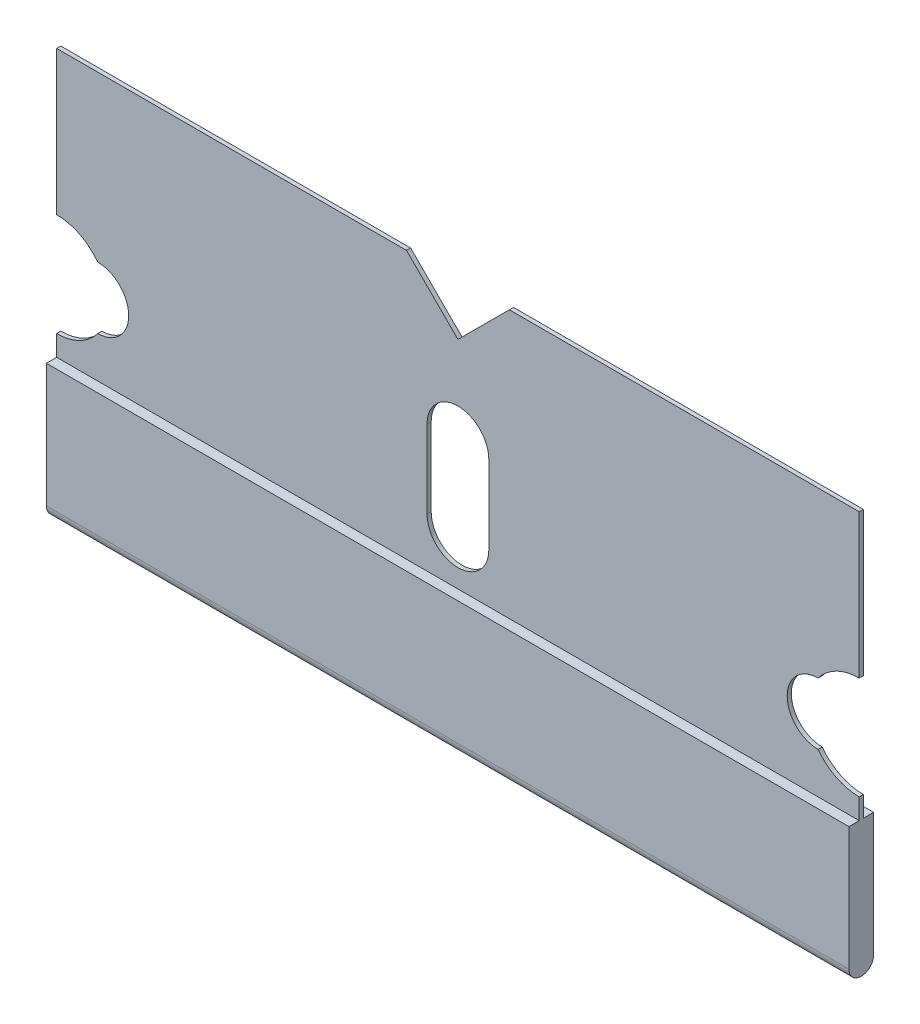
from build123d import *

# Parameters (mm, degrees)
BOSS_EXTRUDE1_DEPTH = 0.2
BOSS_EXTRUDE2_DEPTH = 39
CUT_EXTRUDE1_DEPTH  = 10


with BuildPart() as part:
    # Sketch1 → Boss-Extrude1 (new body)
    with BuildSketch(Plane.XY):
        with BuildLine():
            Line((0, 0), (39, 0))
            Line((39, 0), (39, 7.5))
            ThreePointArc((39, 7.5), (37.881966011, 7.763932023), (37, 8.5))
            ThreePointArc((37, 8.5), (35.5, 10), (37, 11.5))
            ThreePointArc((37, 11.5), (37.881966011, 12.236067977), (39, 12.5))
            Line((39, 12.5), (39, 19.5))
            Line((39, 19.5), (0, 19.5))
            Line((0, 19.5), (0, 12.5))
            ThreePointArc((0, 12.5), (1.118033989, 12.236067977), (2, 11.5))
            ThreePointArc((2, 11.5), (3.5, 10), (2, 8.5))
            ThreePointArc((2, 8.5), (1.118033989, 7.763932023), (0, 7.5))
            Line((0, 7.5), (0, 0))
        make_face()
        with BuildLine():
            Line((21, 12.7), (21, 8.9))
            ThreePointArc((21, 8.9), (19.5, 7.4), (18, 8.9))
            Line((18, 8.9), (18, 12.7))
            ThreePointArc((18, 12.7), (19.5, 14.2), (21, 12.7))
        make_face(mode=Mode.SUBTRACT)
    extrude(amount=BOSS_EXTRUDE1_DEPTH)

    # Sketch2 → Boss-Extrude2 (add)
    with BuildSketch(Plane(origin=(39, 0, 0), x_dir=(0, 0, -1), z_dir=(1, 0, 0))):
        with BuildLine():
            Line((-0.7, 0.5), (-0.7, 6.5))
            Line((-0.7, 6.5), (-0.2, 6.5))
            Line((-0.2, 6.5), (-0.2, 0))
            Line((-0.2, 0), (0, 0))
            Line((0, 0), (0, 6.5))
            Line((0, 6.5), (0.5, 6.5))
            Line((0.5, 6.5), (0.5, 0.5))
            ThreePointArc((0.5, 0.5), (-0.1, -0.1), (-0.7, 0.5))
        make_face()
    extrude(amount=-BOSS_EXTRUDE2_DEPTH)

    # Sketch3 → Cut-Extrude1 (cut)
    with BuildSketch(Plane.XY.offset(0.2)):
        Polygon((17, 19.5), (19.5, 17.002927863), (22, 19.5), (22, 22.539691699), (17, 22.539691699), align=None)
    extrude(amount=-CUT_EXTRUDE1_DEPTH, mode=Mode.SUBTRACT)


solid = part.part
